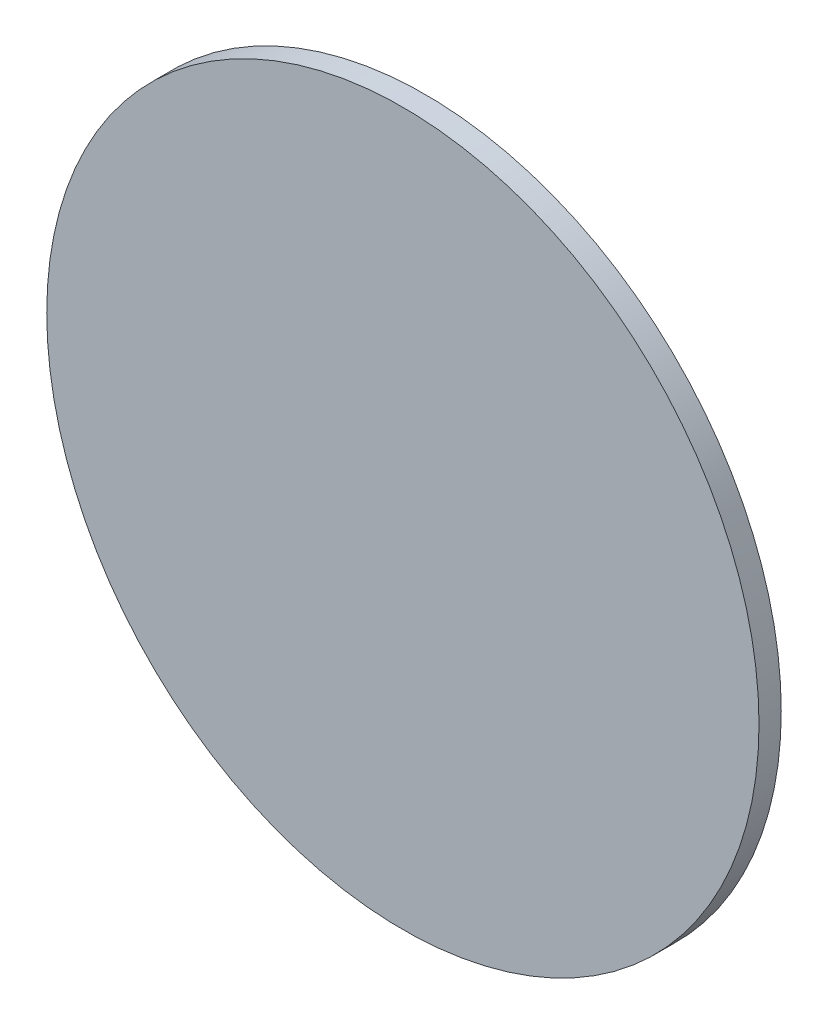
from build123d import *

# Parameters (mm, degrees)
SKETCH1_R           = 50.8
BOSS_EXTRUDE1_DEPTH = 3.175


with BuildPart() as part:
    # Sketch1 → Boss-Extrude1 (new body)
    with BuildSketch(Plane.XY):
        Circle(SKETCH1_R)
    extrude(amount=BOSS_EXTRUDE1_DEPTH)


solid = part.part
